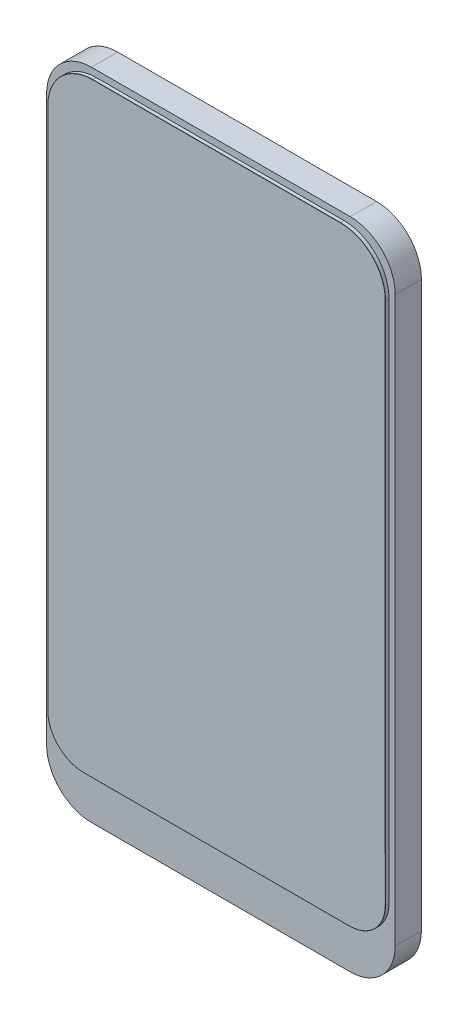
from build123d import *

# Parameters (mm, degrees)
BOSS_EXTRU_1_DEPTH = 1.46
BOSS_EXTRU_2_DEPTH = 0.15
BOSS_EXTRU_3_DEPTH = 0.2
CONG_1_R           = 0.01
CONTACTS_W         = 9.78910699
CONTACTS_H         = 1.999751064
BOSS_EXTRU_4_DEPTH = 0.2


with BuildPart() as part:
    # bordexterne → Boss.-Extru.1 (new body)
    with BuildSketch(Plane.XY):
        with BuildLine():
            Line((-7.154775328, -19.206177595), (7.239809861, -19.206177595))
            ThreePointArc((7.239809861, -19.206177595), (9.007576814, -18.473944548), (9.739809861, -16.706177595))
            Line((9.739809861, -16.706177595), (9.739809861, 14.688353392))
            ThreePointArc((9.739809861, 14.688353392), (9.007576814, 16.456120345), (7.239809861, 17.188353392))
            Line((7.239809861, 17.188353392), (-7.154775328, 17.188353392))
            ThreePointArc((-7.154775328, 17.188353392), (-8.922542281, 16.456120345), (-9.654775328, 14.688353392))
            Line((-9.654775328, 14.688353392), (-9.654775328, -16.706177595))
            ThreePointArc((-9.654775328, -16.706177595), (-8.922542281, -18.473944548), (-7.154775328, -19.206177595))
        make_face()
    extrude(amount=-BOSS_EXTRU_1_DEPTH)

    # surfaceutile → Boss.-Extru.2 (add)
    with BuildSketch(Plane.XY):
        with BuildLine():
            Line((-6.695, -16.175), (6.695, -16.175))
            ThreePointArc((6.695, -16.175), (8.109213562, -15.589213562), (8.695, -14.175))
            Line((8.695, -14.175), (8.695, 14.175))
            ThreePointArc((8.695, 14.175), (8.109213562, 15.589213562), (6.695, 16.175))
            Line((6.695, 16.175), (-6.695, 16.175))
            ThreePointArc((-6.695, 16.175), (-8.109213562, 15.589213562), (-8.695, 14.175))
            Line((-8.695, 14.175), (-8.695, -14.175))
            ThreePointArc((-8.695, -14.175), (-8.109213562, -15.589213562), (-6.695, -16.175))
        make_face()
    extrude(amount=BOSS_EXTRU_2_DEPTH)

    # bord2 → Boss.-Extru.3 (add)
    with BuildSketch(Plane.XY):
        with BuildLine():
            Line((-7.395, -16.825), (7.395, -16.825))
            ThreePointArc((7.395, -16.825), (8.809213562, -16.239213562), (9.395, -14.825))
            Line((9.395, -14.825), (9.395, 14.325))
            ThreePointArc((9.395, 14.325), (8.662766953, 16.092766953), (6.895, 16.825))
            Line((6.895, 16.825), (-6.895, 16.825))
            ThreePointArc((-6.895, 16.825), (-8.662766953, 16.092766953), (-9.395, 14.325))
            Line((-9.395, 14.325), (-9.395, -14.825))
            ThreePointArc((-9.395, -14.825), (-8.809213562, -16.239213562), (-7.395, -16.825))
        make_face()
    extrude(amount=BOSS_EXTRU_3_DEPTH)

    # Congé1
    cong_1_edges = [part.edges().sort_by_distance(p)[0] for p in [
        (8.809213562, -16.239213562, 0.2),
        (9.395, -0.25, 0.2),
        (8.662766953, 16.092766953, 0.2),
        (0, 16.825, 0.2),
        (-8.662766953, 16.092766953, 0.2),
        (-9.395, -0.25, 0.2),
        (-8.809213562, -16.239213562, 0.2),
        (0, -16.825, 0.2),
    ]]
    fillet(cong_1_edges, radius=CONG_1_R)

    # contacts → Boss.-Extru.4 (add)
    with BuildSketch(Plane(origin=(0, 0, -1.46), x_dir=(-1, 0, 0), z_dir=(0, 0, -1))):
        with Locations((-0.066948969, -4.908420558)):
            Rectangle(CONTACTS_W, CONTACTS_H)
    extrude(amount=BOSS_EXTRU_4_DEPTH)


solid = part.part
